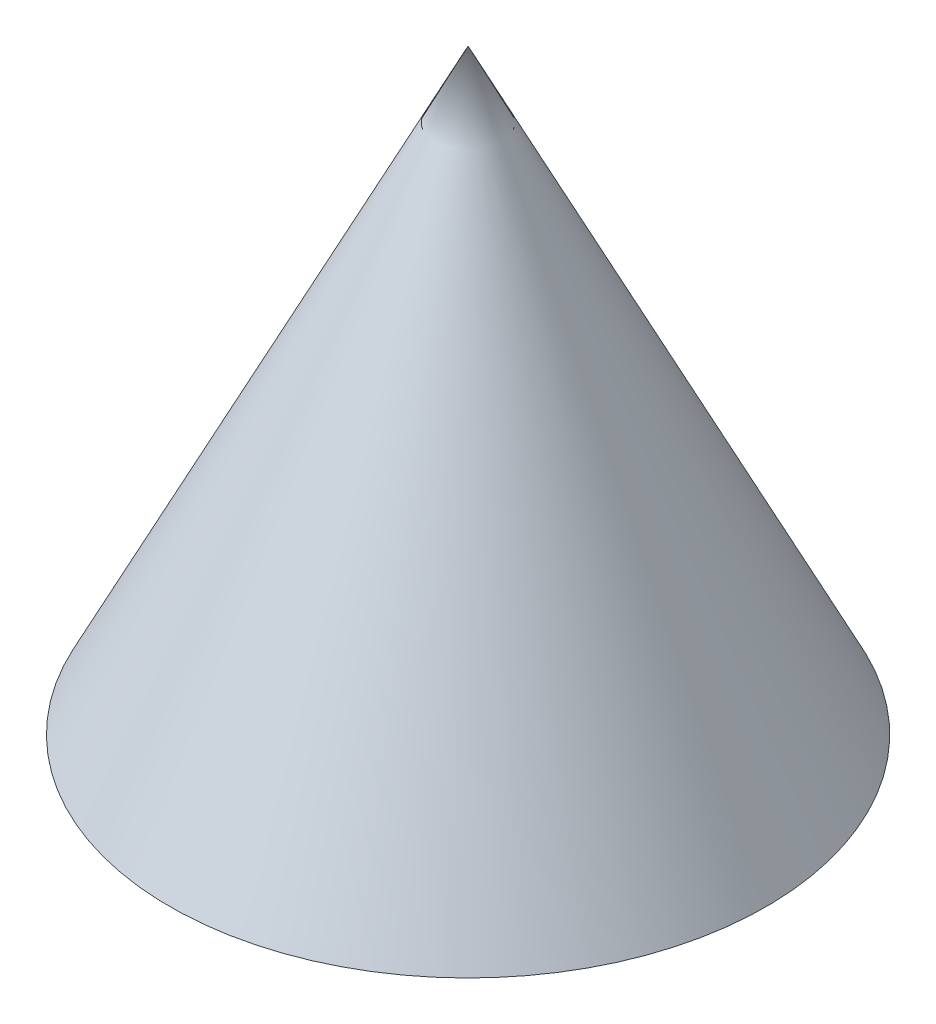
from build123d import *


with BuildPart() as part:
    # 草图1 → 旋转1 (revolve)
    with BuildSketch(Plane.XY, mode=Mode.PRIVATE) as revolve_1_sk:
        Polygon((0, 0), (100, 0), (0, 200), align=None)
    revolve(revolve_1_sk.sketch.rotate(Axis((0, 0, 0), (0, 1, 0)), 90), axis=Axis((0, 0, 0), (0, 1, 0)))


solid = part.part
